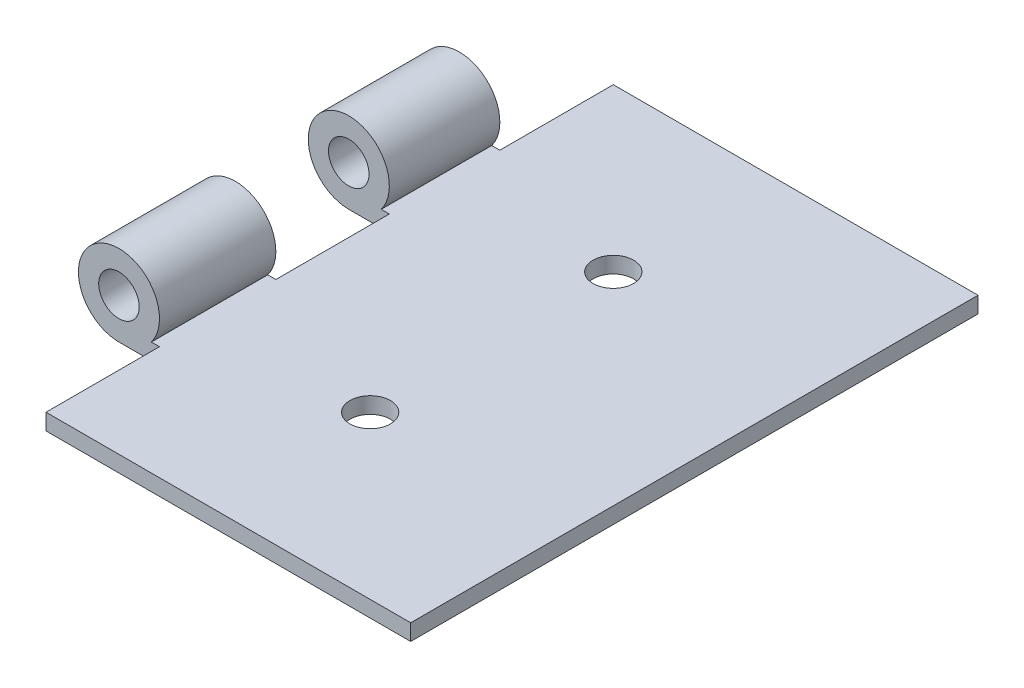
from build123d import *

# Parameters (mm, degrees)
SKETCH1_W               = 50
SKETCH1_H               = 70
BOSS_EXTRUDE1_DEPTH     = 2
SKETCH2_R               = 5
SKETCH2_R_2             = 2.5
BOSS_EXTRUDE2_DEPTH     = 70
SKETCH3_R               = 2.5
CUT_EXTRUDE1_DEPTH      = 47.786750261
CUT_EXTRUDE2_DEPTH      = 47.786750261
CUT_EXTRUDE2_DEPTH_BACK = 47.786750261
SKETCH4_W               = 10
SKETCH4_H               = 14


with BuildPart() as part:
    # Sketch1 → Boss-Extrude1 (new body)
    with BuildSketch(Plane(origin=(0, 0, 0), x_dir=(1, 0, 0), z_dir=(0, 1, 0))):
        Rectangle(SKETCH1_W, SKETCH1_H)
    extrude(amount=BOSS_EXTRUDE1_DEPTH)

    # Sketch2 → Boss-Extrude2 (add)
    with BuildSketch(Plane.XY.offset(35)):
        with Locations((-25, 5)):
            Circle(SKETCH2_R)
        with Locations((-25, 5)):
            Circle(SKETCH2_R_2, mode=Mode.SUBTRACT)
    extrude(amount=-BOSS_EXTRUDE2_DEPTH)

    # Sketch3 → Cut-Extrude1 (cut, through all)
    with BuildSketch(Plane(origin=(0, 2, 0), x_dir=(1, 0, 0), z_dir=(0, 1, 0))):
        with Locations(Location((0, 15, 0), (0, 0, 270))):
            Circle(SKETCH3_R)
        with Locations(Location((0, -15, 0), (0, 0, 270))):
            Circle(SKETCH3_R)
    extrude(amount=-CUT_EXTRUDE1_DEPTH, mode=Mode.SUBTRACT)

    # Sketch4 → Cut-Extrude2 (cut, two sides: drawn at the far end of the back side and taken through both)
    with BuildSketch(Plane(origin=(0, 2, 0), x_dir=(1, 0, 0), z_dir=(0, 1, 0)).offset(-CUT_EXTRUDE2_DEPTH_BACK)):
        with Locations((-25, 28)):
            Rectangle(SKETCH4_W, SKETCH4_H)
        with Locations((-25, 0.360390559)):
            Rectangle(SKETCH4_W, SKETCH4_H)
        with Locations((-25, -28)):
            Rectangle(SKETCH4_W, SKETCH4_H)
    extrude(amount=CUT_EXTRUDE2_DEPTH + CUT_EXTRUDE2_DEPTH_BACK, mode=Mode.SUBTRACT)


solid = part.part
